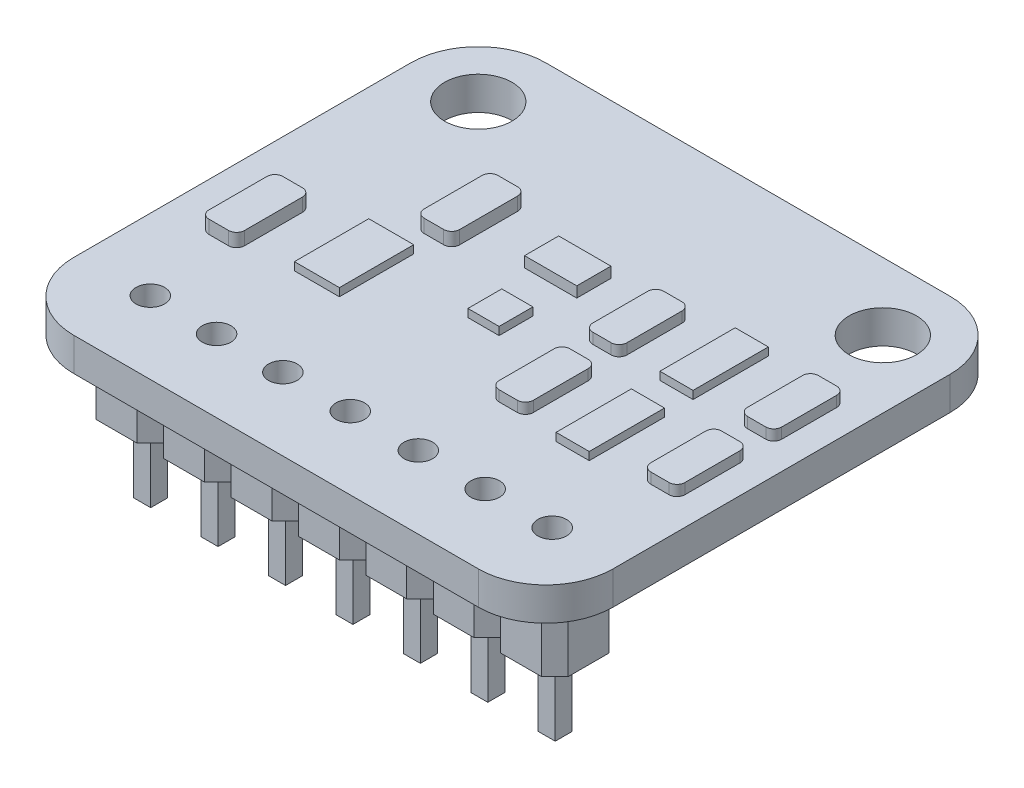
from build123d import *

# Parameters (mm, degrees)
SKETCH1_R           = 1.27
SKETCH1_R_2         = 0.54
BOSS_EXTRUDE1_DEPTH = 1.25
BOSS_EXTRUDE2_DEPTH = 1.75
SKETCH1_5_W         = 1.968161703
SKETCH1_5_H         = 1.28687496
BOSS_EXTRUDE3_DEPTH = 1.65
SKETCH1_6_W         = 1.695032775
SKETCH1_6_H         = 2.800548941
SKETCH1_6_W_2       = 1.249025696
SKETCH1_6_H_2       = 2.83658391
SKETCH1_6_W_3       = 1.249025697
SKETCH1_6_W_4       = 1.17332717
SKETCH1_6_H_3       = 1.274258539
BOSS_EXTRUDE4_DEPTH = 1.55
SKETCH2_W           = 2.54
SKETCH2_H           = 2.54
BOSS_EXTRUDE5_DEPTH = 2.54
CHAMFER1_SIZE       = 0.5
SKETCH3_W           = 0.64
SKETCH3_H           = 0.64
BOSS_EXTRUDE6_DEPTH = 3
CHAMFER2_SIZE       = 0.2
LPATTERN1_COUNT     = 7
LPATTERN1_PITCH     = 2.54


with BuildPart() as part:
    # Sketch1 → Boss-Extrude1 (new body)
    with BuildSketch(Plane(origin=(0, 0, 0), x_dir=(1, 0, 0), z_dir=(0, 1, 0))):
        with BuildLine():
            Line((-9.341092896, 12.191074681), (5.898907104, 12.191074681))
            ThreePointArc((5.898907104, 12.191074681), (7.694958328, 11.447125905), (8.438907104, 9.651074681))
            Line((8.438907104, 9.651074681), (8.438907104, -3.048925319))
            ThreePointArc((8.438907104, -3.048925319), (7.694958328, -4.844976543), (5.898907104, -5.588925319))
            Line((5.898907104, -5.588925319), (-9.341092896, -5.588925319))
            ThreePointArc((-9.341092896, -5.588925319), (-11.13714412, -4.844976543), (-11.881092896, -3.048925319))
            Line((-11.881092896, -3.048925319), (-11.881092896, 9.651074681))
            ThreePointArc((-11.881092896, 9.651074681), (-11.13714412, 11.447125905), (-9.341092896, 12.191074681))
        make_face()
        with Locations(Location((-9.341092896, 9.651074681, 0), (0, 0, 270))):
            Circle(SKETCH1_R, mode=Mode.SUBTRACT)
        with Locations(Location((5.898907104, 9.651074681, 0), (0, 0, 270))):
            Circle(SKETCH1_R, mode=Mode.SUBTRACT)
        with Locations(Location((-6.694139481, -2.855450483, 0), (0, 0, 270))):
            Circle(SKETCH1_R_2, mode=Mode.SUBTRACT)
        with Locations(Location((-4.197875939, -2.855450483, 0), (0, 0, 270))):
            Circle(SKETCH1_R_2, mode=Mode.SUBTRACT)
        with Locations(Location((-1.657036262, -2.855450483, 0), (0, 0, 270))):
            Circle(SKETCH1_R_2, mode=Mode.SUBTRACT)
        with Locations(Location((0.906091482, -2.855450483, 0), (0, 0, 270))):
            Circle(SKETCH1_R_2, mode=Mode.SUBTRACT)
        with Locations(Location((3.424643092, -2.855450483, 0), (0, 0, 270))):
            Circle(SKETCH1_R_2, mode=Mode.SUBTRACT)
        with Locations(Location((5.949204526, -2.855450483, 0), (0, 0, 270))):
            Circle(SKETCH1_R_2, mode=Mode.SUBTRACT)
        with Locations(Location((-9.190403023, -2.855450483, 0), (0, 0, 270))):
            Circle(SKETCH1_R_2, mode=Mode.SUBTRACT)
    extrude(amount=BOSS_EXTRUDE1_DEPTH)

    # Sketch1<4> → Boss-Extrude2 (add)
    with BuildSketch(Plane(origin=(0, 0, 0), x_dir=(1, 0, 0), z_dir=(0, 1, 0))):
        with BuildLine():
            Line((-6.063818684, 7.114875355), (-5.322945137, 7.114875355))
            ThreePointArc((-5.322945137, 7.114875355), (-5.110813103, 7.02700739), (-5.022945137, 6.814875355))
            Line((-5.022945137, 6.814875355), (-5.022945137, 4.631105275))
            ThreePointArc((-5.022945137, 4.631105275), (-5.110813103, 4.418973241), (-5.322945137, 4.331105275))
            Line((-5.322945137, 4.331105275), (-6.063818684, 4.331105275))
            ThreePointArc((-6.063818684, 4.331105275), (-6.275950718, 4.418973241), (-6.363818684, 4.631105275))
            Line((-6.363818684, 4.631105275), (-6.363818684, 6.814875355))
            ThreePointArc((-6.363818684, 6.814875355), (-6.275950718, 7.02700739), (-6.063818684, 7.114875355))
        make_face()
        with BuildLine():
            Line((-10.084107604, 3.030771759), (-9.343234057, 3.030771759))
            ThreePointArc((-9.343234057, 3.030771759), (-9.131102023, 2.942903793), (-9.043234057, 2.730771759))
            Line((-9.043234057, 2.730771759), (-9.043234057, 0.547001679))
            ThreePointArc((-9.043234057, 0.547001679), (-9.131102023, 0.334869645), (-9.343234057, 0.247001679))
            Line((-9.343234057, 0.247001679), (-10.084107604, 0.247001679))
            ThreePointArc((-10.084107604, 0.247001679), (-10.296239638, 0.334869645), (-10.384107604, 0.547001679))
            Line((-10.384107604, 0.547001679), (-10.384107604, 2.730771759))
            ThreePointArc((-10.384107604, 2.730771759), (-10.296239638, 2.942903793), (-10.084107604, 3.030771759))
        make_face()
    extrude(amount=BOSS_EXTRUDE2_DEPTH)

    # Sketch1<5> → Boss-Extrude3 (add)
    with BuildSketch(Plane(origin=(0, 0, 0), x_dir=(1, 0, 0), z_dir=(0, 1, 0))):
        with BuildLine():
            Line((6.387412847, 3.090141106), (7.074287807, 3.090141106))
            ThreePointArc((7.074287807, 3.090141106), (7.286419842, 3.002273141), (7.374287807, 2.790141106))
            Line((7.374287807, 2.790141106), (7.374287807, 0.720907656))
            ThreePointArc((7.374287807, 0.720907656), (7.286419842, 0.508775621), (7.074287807, 0.420907656))
            Line((7.074287807, 0.420907656), (6.387412847, 0.420907656))
            ThreePointArc((6.387412847, 0.420907656), (6.175280813, 0.508775621), (6.087412847, 0.720907656))
            Line((6.087412847, 0.720907656), (6.087412847, 2.790141106))
            ThreePointArc((6.087412847, 2.790141106), (6.175280813, 3.002273141), (6.387412847, 3.090141106))
        make_face()
        with Locations((-2.062795234, 5.742313473)):
            Rectangle(SKETCH1_5_W, SKETCH1_5_H)
        with BuildLine():
            Line((0.84880395, 2.916235129), (1.53567891, 2.916235129))
            ThreePointArc((1.53567891, 2.916235129), (1.747810945, 2.828367164), (1.83567891, 2.616235129))
            Line((1.83567891, 2.616235129), (1.83567891, 0.547001679))
            ThreePointArc((1.83567891, 0.547001679), (1.747810945, 0.334869645), (1.53567891, 0.247001679))
            Line((1.53567891, 0.247001679), (0.84880395, 0.247001679))
            ThreePointArc((0.84880395, 0.247001679), (0.636671916, 0.334869645), (0.54880395, 0.547001679))
            Line((0.54880395, 0.547001679), (0.54880395, 2.616235129))
            ThreePointArc((0.54880395, 2.616235129), (0.636671916, 2.828367164), (0.84880395, 2.916235129))
        make_face()
        with BuildLine():
            Line((6.400029269, 6.723670405), (7.086904229, 6.723670405))
            ThreePointArc((7.086904229, 6.723670405), (7.299036263, 6.63580244), (7.386904229, 6.423670405))
            Line((7.386904229, 6.423670405), (7.386904229, 4.354436955))
            ThreePointArc((7.386904229, 4.354436955), (7.299036263, 4.142304921), (7.086904229, 4.054436955))
            Line((7.086904229, 4.054436955), (6.400029269, 4.054436955))
            ThreePointArc((6.400029269, 4.054436955), (6.187897234, 4.142304921), (6.100029269, 4.354436955))
            Line((6.100029269, 4.354436955), (6.100029269, 6.423670405))
            ThreePointArc((6.100029269, 6.423670405), (6.187897234, 6.63580244), (6.400029269, 6.723670405))
        make_face()
        with BuildLine():
            Line((0.73525616, 6.55965693), (1.42213112, 6.55965693))
            ThreePointArc((1.42213112, 6.55965693), (1.634263154, 6.471788964), (1.72213112, 6.25965693))
            Line((1.72213112, 6.25965693), (1.72213112, 4.19042348))
            ThreePointArc((1.72213112, 4.19042348), (1.634263154, 3.978291445), (1.42213112, 3.89042348))
            Line((1.42213112, 3.89042348), (0.73525616, 3.89042348))
            ThreePointArc((0.73525616, 3.89042348), (0.523124125, 3.978291445), (0.43525616, 4.19042348))
            Line((0.43525616, 4.19042348), (0.43525616, 6.25965693))
            ThreePointArc((0.43525616, 6.25965693), (0.523124125, 6.471788964), (0.73525616, 6.55965693))
        make_face()
    extrude(amount=BOSS_EXTRUDE3_DEPTH)

    # Sketch1<6> → Boss-Extrude4 (add)
    with BuildSketch(Plane(origin=(0, 0, 0), x_dir=(1, 0, 0), z_dir=(0, 1, 0))):
        with Locations((-6.439231346, 2.069942811)):
            Rectangle(SKETCH1_6_W, SKETCH1_6_H)
        with Locations((3.835381667, 1.44747749)):
            Rectangle(SKETCH1_6_W_2, SKETCH1_6_H_2)
        with Locations((3.797532403, 5.3965834)):
            Rectangle(SKETCH1_6_W_3, SKETCH1_6_H_2)
        with Locations((-1.905089969, 3.048707552)):
            Rectangle(SKETCH1_6_W_4, SKETCH1_6_H_3)
    extrude(amount=BOSS_EXTRUDE4_DEPTH)


with BuildPart() as body_2:
    # Sketch2 → Boss-Extrude5 (new body)
    with BuildSketch(Plane.XZ):
        with Locations((-9.190403023, 2.855450483)):
            Rectangle(SKETCH2_W, SKETCH2_H)
    extrude(amount=BOSS_EXTRUDE5_DEPTH)

    # Chamfer1
    chamfer1_edges = [body_2.edges().sort_by_distance(p)[0] for p in [
        (-10.460403023, -1.27, 1.585450483),
        (-10.460403023, -1.27, 4.125450483),
        (-7.920403023, -1.27, 4.125450483),
        (-7.920403023, -1.27, 1.585450483),
    ]]
    chamfer(chamfer1_edges, length=CHAMFER1_SIZE)

    # Sketch3 → Boss-Extrude6 (add)
    with BuildSketch(Plane.XZ.offset(2.54)):
        with Locations((-9.176736052, 2.855450483)):
            Rectangle(SKETCH3_W, SKETCH3_H)
    extrude(amount=BOSS_EXTRUDE6_DEPTH)

    # Chamfer2
    chamfer2_edges = [body_2.edges().sort_by_distance(p)[0] for p in [
        (-9.496736052, -5.54, 2.855450483),
        (-9.176736052, -5.54, 2.535450483),
        (-8.856736052, -5.54, 2.855450483),
        (-9.176736052, -5.54, 3.175450483),
    ]]
    chamfer(chamfer2_edges, length=CHAMFER2_SIZE)


with BuildPart() as lpattern1_1:
    # LPattern1: pattern copy
    add(body_2.part.moved(Location(Vector(1, 0, 0) * (1 * LPATTERN1_PITCH))))


with BuildPart() as lpattern1_2:
    # LPattern1: pattern copy
    add(body_2.part.moved(Location(Vector(1, 0, 0) * (2 * LPATTERN1_PITCH))))


with BuildPart() as lpattern1_3:
    # LPattern1: pattern copy
    add(body_2.part.moved(Location(Vector(1, 0, 0) * (3 * LPATTERN1_PITCH))))


with BuildPart() as lpattern1_4:
    # LPattern1: pattern copy
    add(body_2.part.moved(Location(Vector(1, 0, 0) * (4 * LPATTERN1_PITCH))))


with BuildPart() as lpattern1_5:
    # LPattern1: pattern copy
    add(body_2.part.moved(Location(Vector(1, 0, 0) * (5 * LPATTERN1_PITCH))))


with BuildPart() as lpattern1_6:
    # LPattern1: pattern copy
    add(body_2.part.moved(Location(Vector(1, 0, 0) * (6 * LPATTERN1_PITCH))))


solid = Compound([part.part, body_2.part, lpattern1_1.part, lpattern1_2.part, lpattern1_3.part, lpattern1_4.part, lpattern1_5.part, lpattern1_6.part])
